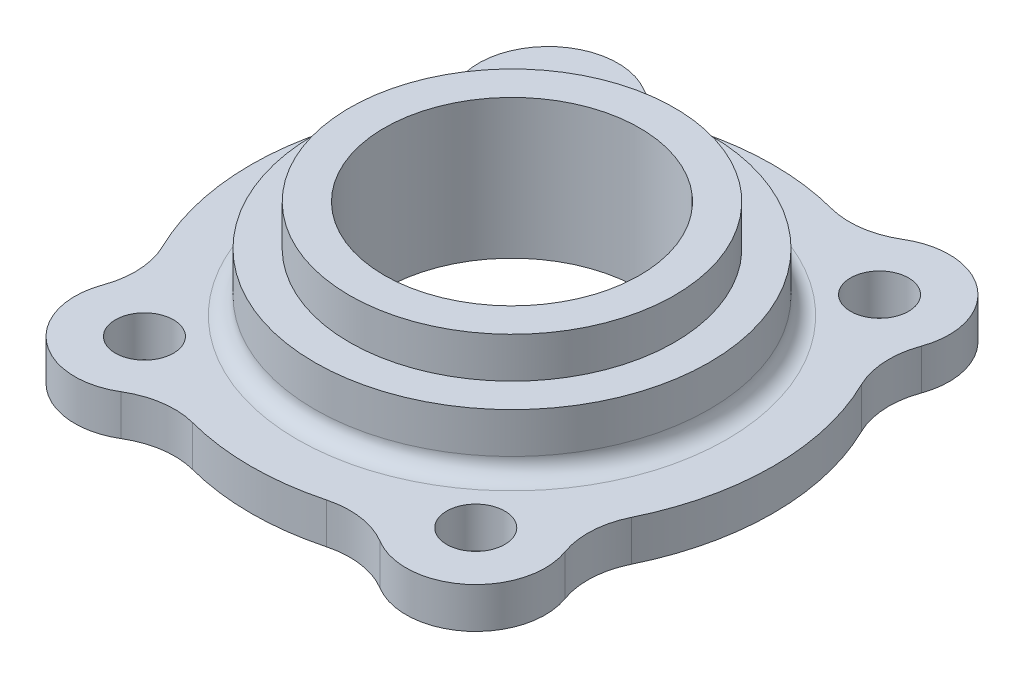
from build123d import *

# Parameters (mm, degrees)
SKETCH2_R           = 14
SKETCH2_R_2         = 11
BOSS_EXTRUDE1_DEPTH = 12
SKETCH3_R           = 17
SKETCH3_R_2         = 14
BOSS_EXTRUDE2_DEPTH = 8.5
SKETCH4_R           = 2.5
SKETCH4_R_2         = 17
BOSS_EXTRUDE3_DEPTH = 3.5
FILLET1_R           = 1.5
FILLET2_R           = 7


with BuildPart() as part:
    # Sketch2 → Boss-Extrude1 (new body)
    with BuildSketch(Plane(origin=(0, 0, 0), x_dir=(1, 0, 0), z_dir=(0, 1, 0))):
        with Locations(Location((0, 0, 0), (0, 0, 270))):
            Circle(SKETCH2_R)
        with Locations(Location((0, 0, 0), (0, 0, 270))):
            Circle(SKETCH2_R_2, mode=Mode.SUBTRACT)
    extrude(amount=BOSS_EXTRUDE1_DEPTH)

    # Sketch3 → Boss-Extrude2 (add)
    with BuildSketch(Plane(origin=(0, 0, 0), x_dir=(1, 0, 0), z_dir=(0, 1, 0))):
        with Locations(Location((0, 0, 0), (0, 0, 270))):
            Circle(SKETCH3_R)
        with Locations(Location((0, 0, 0), (0, 0, 270))):
            Circle(SKETCH3_R_2, mode=Mode.SUBTRACT)
    extrude(amount=BOSS_EXTRUDE2_DEPTH)

    # Sketch4 → Boss-Extrude3 (add)
    with BuildSketch(Plane(origin=(0, 0, 0), x_dir=(1, 0, 0), z_dir=(0, 1, 0))):
        with BuildLine():
            ThreePointArc((-18.361144712, 13.004551698), (-22.5, 0), (-18.361144712, -13.004551698))
            ThreePointArc((-18.361144712, -13.004551698), (-18.077090702, -22.033356344), (-9.166775866, -20.547997962))
            ThreePointArc((-9.166775866, -20.547997962), (0, -22.5), (9.166775866, -20.547997962))
            ThreePointArc((9.166775866, -20.547997962), (18.077090702, -22.033356344), (18.361144712, -13.004551698))
            ThreePointArc((18.361144712, -13.004551698), (22.5, 0), (18.361144712, 13.004551698))
            ThreePointArc((18.361144712, 13.004551698), (18.077090702, 22.033356344), (9.166775866, 20.547997962))
            ThreePointArc((9.166775866, 20.547997962), (0, 22.5), (-9.166775866, 20.547997962))
            ThreePointArc((-9.166775866, 20.547997962), (-18.077090702, 22.033356344), (-18.361144712, 13.004551698))
        make_face()
        with Locations(Location((-14.271387396, 17.394755008, 0), (0, 0, 270))):
            Circle(SKETCH4_R, mode=Mode.SUBTRACT)
        with Locations(Location((14.271387396, 17.394755008, 0), (0, 0, 270))):
            Circle(SKETCH4_R, mode=Mode.SUBTRACT)
        with Locations(Location((-14.271387396, -17.394755008, 0), (0, 0, 270))):
            Circle(SKETCH4_R, mode=Mode.SUBTRACT)
        with Locations(Location((14.271387396, -17.394755008, 0), (0, 0, 270))):
            Circle(SKETCH4_R, mode=Mode.SUBTRACT)
        with Locations(Location((0, 0, 0), (0, 0, 270))):
            Circle(SKETCH4_R_2, mode=Mode.SUBTRACT)
    extrude(amount=BOSS_EXTRUDE3_DEPTH)

    # Fillet1
    fillet1_edges = [part.edges().sort_by_distance(p)[0] for p in [
        (0, 3.5, -17),
    ]]
    fillet(fillet1_edges, radius=FILLET1_R)

    # Fillet2
    fillet2_edges = [part.edges().sort_by_distance(p)[0] for p in [
        (-9.166775866, 1.75, 20.547997962),
        (9.166775866, 1.75, 20.547997962),
        (18.361144712, 1.75, 13.004551698),
        (18.361144712, 1.75, -13.004551698),
        (9.166775866, 1.75, -20.547997962),
        (-9.166775866, 1.75, -20.547997962),
        (-18.361144712, 1.75, -13.004551698),
        (-18.361144712, 1.75, 13.004551698),
    ]]
    fillet(fillet2_edges, radius=FILLET2_R)


solid = part.part
